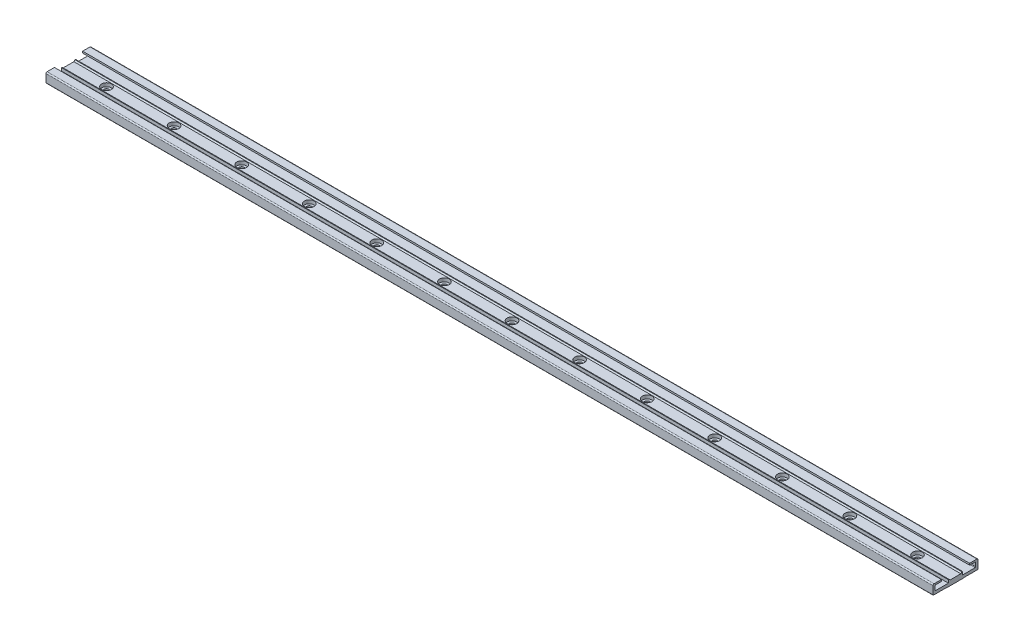
from build123d import *

# Parameters (mm, degrees)
BOSS_EXTRUDE1_DEPTH             = 787.4
CBORE_FOR_M4_SBHCS1_D           = 4.5
CBORE_FOR_M4_SBHCS1_CBORE_D     = 8.6
CBORE_FOR_M4_SBHCS1_CBORE_DEPTH = 3.1
LPATTERN1_COUNT                 = 13
LPATTERN1_PITCH                 = 60


with BuildPart() as part:
    # Sketch1 → Boss-Extrude1 (new body)
    with BuildSketch(Plane(origin=(0, 0, 0), x_dir=(0, 0, -1), z_dir=(1, 0, 0))):
        with BuildLine():
            Line((-8, 0.2), (-8, 0))
            Line((-8, 0), (8, 0))
            Line((8, 0), (8, 0.2))
            Line((8, 0.2), (19.5, 0.2))
            ThreePointArc((19.5, 0.2), (19.853553391, 0.346446609), (20, 0.7))
            Line((20, 0.7), (20, 7.7))
            ThreePointArc((20, 7.7), (19.707106781, 8.407106781), (19, 8.7))
            Line((19, 8.7), (12.5, 8.7))
            Line((12.5, 8.7), (12.5, 7.2))
            Line((12.5, 7.2), (17.5, 7.2))
            ThreePointArc((17.5, 7.2), (17.853553391, 7.053553391), (18, 6.7))
            Line((18, 6.7), (18, 3.3))
            ThreePointArc((18, 3.3), (17.853553391, 2.946446609), (17.5, 2.8))
            Line((17.5, 2.8), (6.3, 2.8))
            Line((6.3, 2.8), (6.3, 5.5))
            Line((6.3, 5.5), (5.75, 5.5))
            Line((5.75, 5.5), (4.75, 4.5))
            Line((4.75, 4.5), (-4.75, 4.5))
            Line((-4.75, 4.5), (-5.75, 5.5))
            Line((-5.75, 5.5), (-6.3, 5.5))
            Line((-6.3, 5.5), (-6.3, 2.8))
            Line((-6.3, 2.8), (-17.5, 2.8))
            ThreePointArc((-17.5, 2.8), (-17.853553391, 2.946446609), (-18, 3.3))
            Line((-18, 3.3), (-18, 6.7))
            ThreePointArc((-18, 6.7), (-17.853553391, 7.053553391), (-17.5, 7.2))
            Line((-17.5, 7.2), (-12.5, 7.2))
            Line((-12.5, 7.2), (-12.5, 8.7))
            Line((-12.5, 8.7), (-19, 8.7))
            ThreePointArc((-19, 8.7), (-19.707106781, 8.407106781), (-20, 7.7))
            Line((-20, 7.7), (-20, 0.7))
            ThreePointArc((-20, 0.7), (-19.853553391, 0.346446609), (-19.5, 0.2))
            Line((-19.5, 0.2), (-8, 0.2))
        make_face()
    extrude(amount=BOSS_EXTRUDE1_DEPTH)

    # CBORE for M4 SBHCS1 (through all)
    with Locations(Plane(origin=(0, 4.5, 0), x_dir=(1, 0, 0), z_dir=(0, 1, 0))):
        with Locations((33.7, 0)):
            cbore_for_m4_sbhcs1 = CounterBoreHole(CBORE_FOR_M4_SBHCS1_D / 2, CBORE_FOR_M4_SBHCS1_CBORE_D / 2, CBORE_FOR_M4_SBHCS1_CBORE_DEPTH)

    # LPattern1: CBORE for M4 SBHCS1 ×13
    with Locations(*[(i * LPATTERN1_PITCH, 0, 0) for i in range(1, LPATTERN1_COUNT)]):
        add(cbore_for_m4_sbhcs1, mode=Mode.SUBTRACT)


solid = part.part
